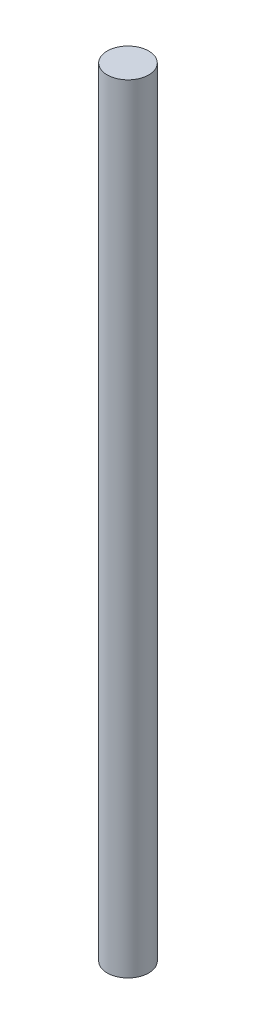
from build123d import *

# Parameters (mm, degrees)
SKETCH_1_R      = 8
EXTRUDE_1_DEPTH = 300


with BuildPart() as part:
    # Эскиз1 → Бобышка-Вытянуть1 (new body)
    with BuildSketch(Plane(origin=(0, 0, 0), x_dir=(1, 0, 0), z_dir=(0, 1, 0))):
        with Locations(Location((0, 0, 0), (0, 0, 270))):
            Circle(SKETCH_1_R)
    extrude(amount=EXTRUDE_1_DEPTH)


solid = part.part
